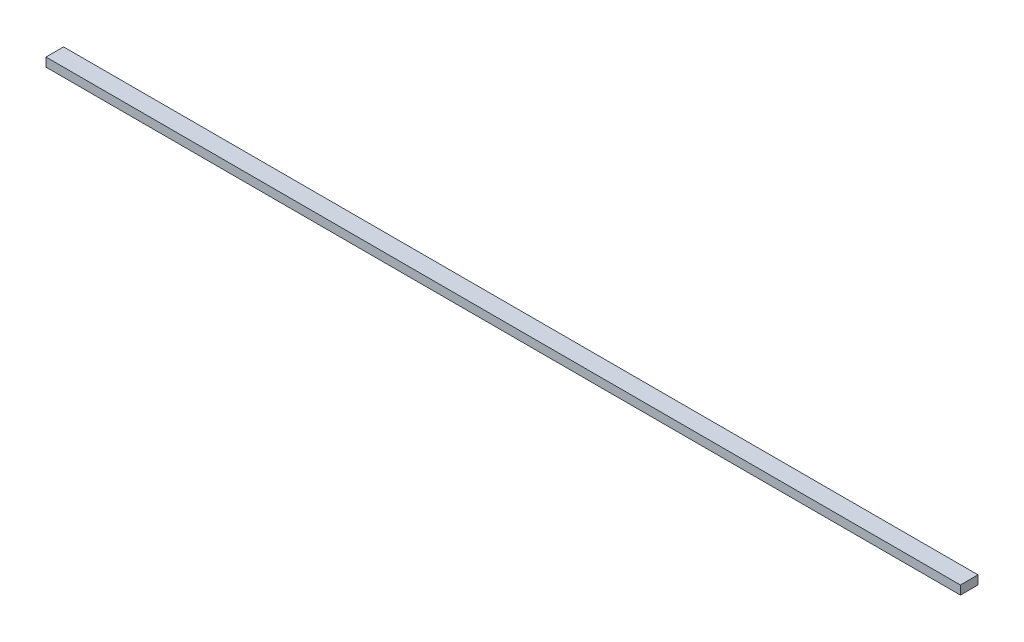
from build123d import *

# Parameters (mm, degrees)
SKETCH_1_W      = 1872
SKETCH_1_H      = 36
EXTRUDE_1_DEPTH = 18


with BuildPart() as part:
    # 草图1 → 凸台-拉伸1 (new body)
    with BuildSketch(Plane(origin=(0, 0, 0), x_dir=(1, 0, 0), z_dir=(0, 1, 0))):
        with Locations((528.500417014, 200.582151793)):
            Rectangle(SKETCH_1_W, SKETCH_1_H)
    extrude(amount=EXTRUDE_1_DEPTH)


solid = part.part
